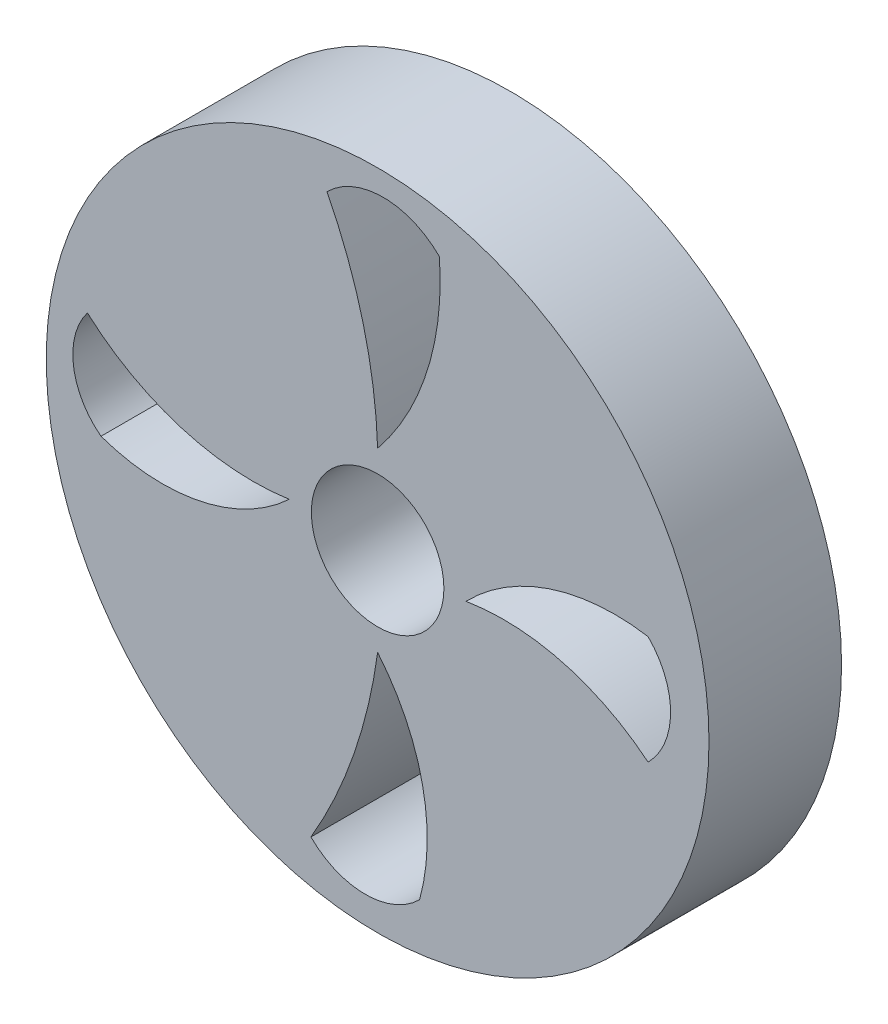
from build123d import *

# Parameters (mm, degrees)
SKETCH1_R           = 75
SKETCH1_R_2         = 15
BOSS_EXTRUDE1_DEPTH = 30
CUT_EXTRUDE1_DEPTH  = 30


with BuildPart() as part:
    # Sketch1 → Boss-Extrude1 (new body)
    with BuildSketch(Plane.XY):
        Circle(SKETCH1_R)
        Circle(SKETCH1_R_2, mode=Mode.SUBTRACT)
    extrude(amount=BOSS_EXTRUDE1_DEPTH)

    # Sketch3 → Cut-Extrude1 (cut)
    with BuildSketch(Plane.XY.offset(30)):
        with BuildLine():
            ThreePointArc((20, 0), (41.783391285, -1.00391685), (61.214489176, -10.901210401))
            ThreePointArc((61.214489176, -10.901210401), (66.308819549, 1.397591077), (61.214489176, 13.696392555))
            ThreePointArc((61.214489176, 13.696392555), (38.925210815, 11.909686918), (20, 0))
        make_face()
        with BuildLine():
            ThreePointArc((0, 20), (11.265284699, 40.943063639), (13.975910771, 64.568707761))
            ThreePointArc((13.975910771, 64.568707761), (1.257831969, 69.836708488), (-11.460246832, 64.568707761))
            ThreePointArc((-11.460246832, 64.568707761), (-3.286702106, 42.912646975), (0, 20))
        make_face()
        with BuildLine():
            ThreePointArc((-20, 0), (-40.056959125, -10.422925538), (-62.612080253, -8.944582893))
            ThreePointArc((-62.612080253, -8.944582893), (-68.838529986, 1.739113534), (-65.686780623, 13.696392555))
            ThreePointArc((-65.686780623, 13.696392555), (-44.364425117, 1.774511129), (-20, 0))
        make_face()
        with BuildLine():
            ThreePointArc((0, -20), (10.122111276, -40.697980205), (9.503619324, -63.730153115))
            ThreePointArc((9.503619324, -63.730153115), (-2.795182154, -68.824483488), (-15.093983632, -63.730153115))
            ThreePointArc((-15.093983632, -63.730153115), (-5.375443737, -42.614612263), (0, -20))
        make_face()
    extrude(amount=-CUT_EXTRUDE1_DEPTH, mode=Mode.SUBTRACT)


solid = part.part
